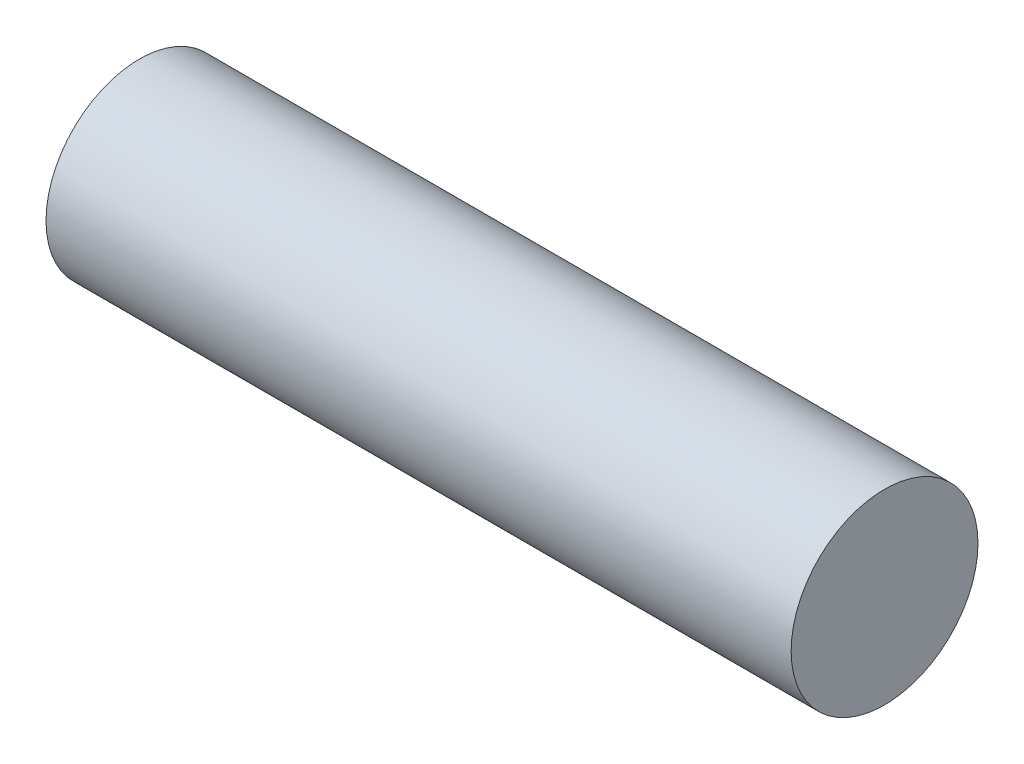
from build123d import *

# Parameters (mm, degrees)
SKETCH2_R           = 5
BOSS_EXTRUDE1_DEPTH = 19.939


with BuildPart() as part:
    # Sketch2 → Boss-Extrude1 (new, symmetric)
    with BuildSketch(Plane.YZ):
        with Locations(Location((0, 0, 0), (0, 0, 270))):
            Circle(SKETCH2_R)
    extrude(amount=BOSS_EXTRUDE1_DEPTH, both=True)


solid = part.part
